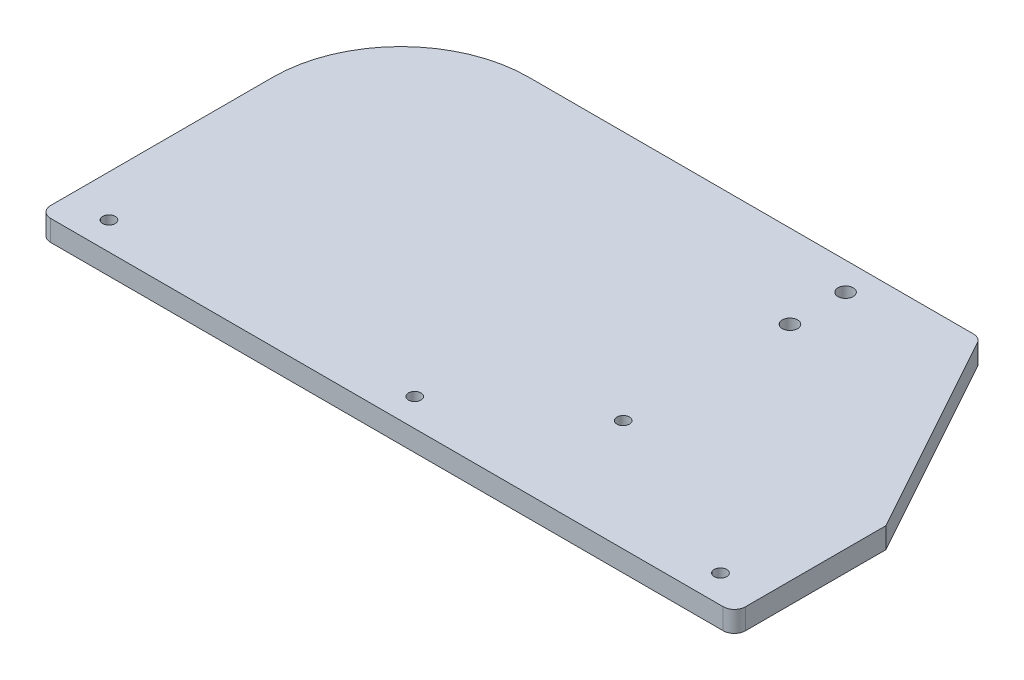
from build123d import *

# Parameters (mm, degrees)
SKETCH1_R           = 2.25
SKETCH1_R_2         = 2.75
BOSS_EXTRUDE1_DEPTH = 7.5


with BuildPart() as part:
    # Sketch1 → Boss-Extrude1 (new body)
    with BuildSketch(Plane(origin=(0, 0, 0), x_dir=(1, 0, 0), z_dir=(0, 1, 0))):
        with BuildLine():
            Line((-166, -10), (76, -10))
            ThreePointArc((76, -10), (78.828427125, -8.828427125), (80, -6))
            Line((80, -6), (80, 44.5))
            Line((80, 44.5), (39.502647377, 117.931699085))
            ThreePointArc((39.502647377, 117.931699085), (38.033863769, 119.444328406), (36, 120))
            Line((36, 120), (-124, 120))
            ThreePointArc((-124, 120), (-156.526911935, 106.526911935), (-170, 74))
            Line((-170, 74), (-170, -6))
            ThreePointArc((-170, -6), (-168.828427125, -8.828427125), (-166, -10))
        make_face()
        with Locations(Location((65, 0, 0), (0, 0, 270))):
            Circle(SKETCH1_R, mode=Mode.SUBTRACT)
        with Locations(Location((-45, 0, 0), (0, 0, 270))):
            Circle(SKETCH1_R, mode=Mode.SUBTRACT)
        with Locations(Location((-155, 0, 0), (0, 0, 270))):
            Circle(SKETCH1_R, mode=Mode.SUBTRACT)
        with Locations(Location((0, 90, 0), (0, 0, 270))):
            Circle(SKETCH1_R_2, mode=Mode.SUBTRACT)
        with Locations(Location((0, 110, 0), (0, 0, 270))):
            Circle(SKETCH1_R_2, mode=Mode.SUBTRACT)
        with Locations(Location((0, 30, 0), (0, 0, 270))):
            Circle(SKETCH1_R, mode=Mode.SUBTRACT)
    extrude(amount=BOSS_EXTRUDE1_DEPTH)


solid = part.part
